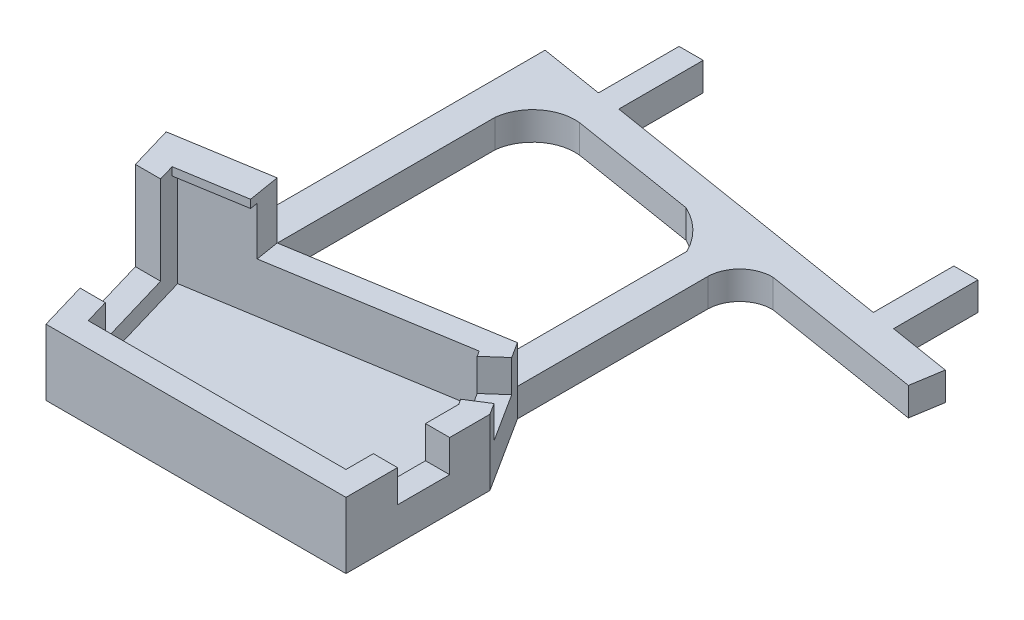
from build123d import *

# Parameters (mm, degrees)
BOSS_EXTRUDE4_DEPTH  = 1.1
BOSS_EXTRUDE6_DEPTH  = 2
BOSS_EXTRUDE8_DEPTH  = 1
BOSS_EXTRUDE9_DEPTH  = 3.5
SKETCH13_W           = 4.301422626
SKETCH13_H           = 0.5
BOSS_EXTRUDE10_DEPTH = 0.5
BOSS_EXTRUDE11_DEPTH = 1.75


with BuildPart() as part:
    # Sketch1 → Boss-Extrude4 (new body)
    with BuildSketch(Plane(origin=(0, 0, 0), x_dir=(1, 0, 0), z_dir=(0, 1, 0))):
        Polygon((-13.958157374, 6.393603317), (4.779918737, 9.461645161), (7.776189987, 4.758788138), (7.776189987, -4.178449178), (-10.845876326, -4.178449178), align=None)
        Polygon((-12.039528162, 5.187772879), (-9.723810013, -2.678449178), (6.276189987, -2.678449178), (6.276189987, 4.321550822), (4.046279675, 7.821550822), align=None, mode=Mode.SUBTRACT)
    extrude(amount=BOSS_EXTRUDE4_DEPTH)

    # Sketch4 → Boss-Extrude6 (add)
    with BuildSketch(Plane(origin=(0, 1.1, 0), x_dir=(1, 0, 0), z_dir=(0, 1, 0))):
        Polygon((4.263894856, 7.479988594), (5.40328595, 8.483226777), (4.779918737, 9.461645161), (-13.958157374, 6.393603317), (-13.161594474, 3.687772879), (-11.597946778, 3.687772879), (-12.039528162, 5.187772879), (4.046279675, 7.821550822), align=None)
        Polygon((6.276189987, -0.978449178), (7.776189987, -0.978449178), (7.776189987, -4.178449178), (-10.845876326, -4.178449178), (-11.729039094, -1.178449178), (-10.165391397, -1.178449178), (-9.723810013, -2.678449178), (6.276189987, -2.678449178), align=None)
        Polygon((6.276189987, 2.258788138), (6.276189987, 4.321550822), (6.061258872, 4.658900219), (7.326319113, 5.464891898), (7.776189987, 4.758788138), (7.776189987, 2.258788138), align=None)
    extrude(amount=BOSS_EXTRUDE6_DEPTH)

    # Sketch8 → Boss-Extrude8 (add)
    with BuildSketch(Plane.XZ):
        Polygon((4.779918737, -9.461645161), (-13.958157374, -6.393603317), (-10.845876326, 4.178449178), (7.776189987, 4.178449178), (7.776189987, -4.758788138), align=None)
    extrude(amount=BOSS_EXTRUDE8_DEPTH)

    # Sketch12 → Boss-Extrude9 (add)
    with BuildSketch(Plane(origin=(0, 3.1, 0), x_dir=(1, 0, 0), z_dir=(0, 1, 0))):
        Polygon((-13.958157374, 6.393603317), (-8.037001115, 7.36309213), (-7.794628912, 5.882803065), (-12.039528162, 5.187772879), (-11.597946778, 3.687772879), (-13.161594474, 3.687772879), align=None)
    extrude(amount=BOSS_EXTRUDE9_DEPTH)

    # Sketch13 → Boss-Extrude10 (add)
    with BuildSketch(Plane(origin=(-1.141567738, 0, -6.972128883), x_dir=(0.9868593764655612, 0, -0.16158146886943345), z_dir=(0.16158146886943345, 0, 0.9868593764655612))):
        with Locations((-8.89236198, 6.35)):
            Rectangle(SKETCH13_W, SKETCH13_H)
    extrude(amount=BOSS_EXTRUDE10_DEPTH)

    # Sketch14 → Boss-Extrude11 (add)
    with BuildSketch(Plane.XZ.offset(1)):
        with BuildLine():
            Line((-12.435718696, -28.393603317), (-8.481738038, -27.756425594))
            Line((-8.481738038, -27.756425594), (-8.481738038, -32.756425594))
            Line((-8.481738038, -32.756425594), (-6.981738038, -32.756425594))
            Line((-6.981738038, -32.756425594), (-6.981738038, -27.514702969))
            Line((-6.981738038, -27.514702969), (11.853577786, -24.479421647))
            Line((11.853577786, -24.479421647), (11.853577786, -29.479421647))
            Line((11.853577786, -29.479421647), (13.353577786, -29.479421647))
            Line((13.353577786, -29.479421647), (13.353577786, -24.237699022))
            Line((13.353577786, -24.237699022), (17.18217535, -23.620726586))
            Line((17.18217535, -23.620726586), (16.863983568, -21.646200317))
            Line((16.863983568, -21.646200317), (6.843172004, -23.261038234))
            ThreePointArc((6.843172004, -23.261038234), (5.406002401, -22.709284639), (4.779918737, -21.302903559))
            Line((4.779918737, -21.302903559), (4.779918737, -9.461645161))
            Line((4.779918737, -9.461645161), (0.667895788, -8.788371214))
            ThreePointArc((0.667895788, -8.788371214), (2.057990663, -9.82529493), (2.779918737, -11.402125424))
            Line((2.779918737, -11.402125424), (2.779918737, -21.982368725))
            ThreePointArc((2.779918737, -21.982368725), (1.794986848, -23.340128824), (0.417030157, -24.296600818))
            Line((0.417030157, -24.296600818), (-7.469758325, -25.567544294))
            ThreePointArc((-7.469758325, -25.567544294), (-9.406227727, -25.006078343), (-10.378501991, -23.239771316))
            Line((-10.378501991, -23.239771316), (-10.378501991, -6.979711114))
            Line((-10.378501991, -6.979711114), (-13.958157374, -6.393603317))
            ThreePointArc((-13.958157374, -6.393603317), (-12.952521948, -7.628113726), (-12.435718696, -9.134179116))
            Line((-12.435718696, -9.134179116), (-12.435718696, -28.393603317))
        make_face()
    extrude(amount=-BOSS_EXTRUDE11_DEPTH)


solid = part.part
